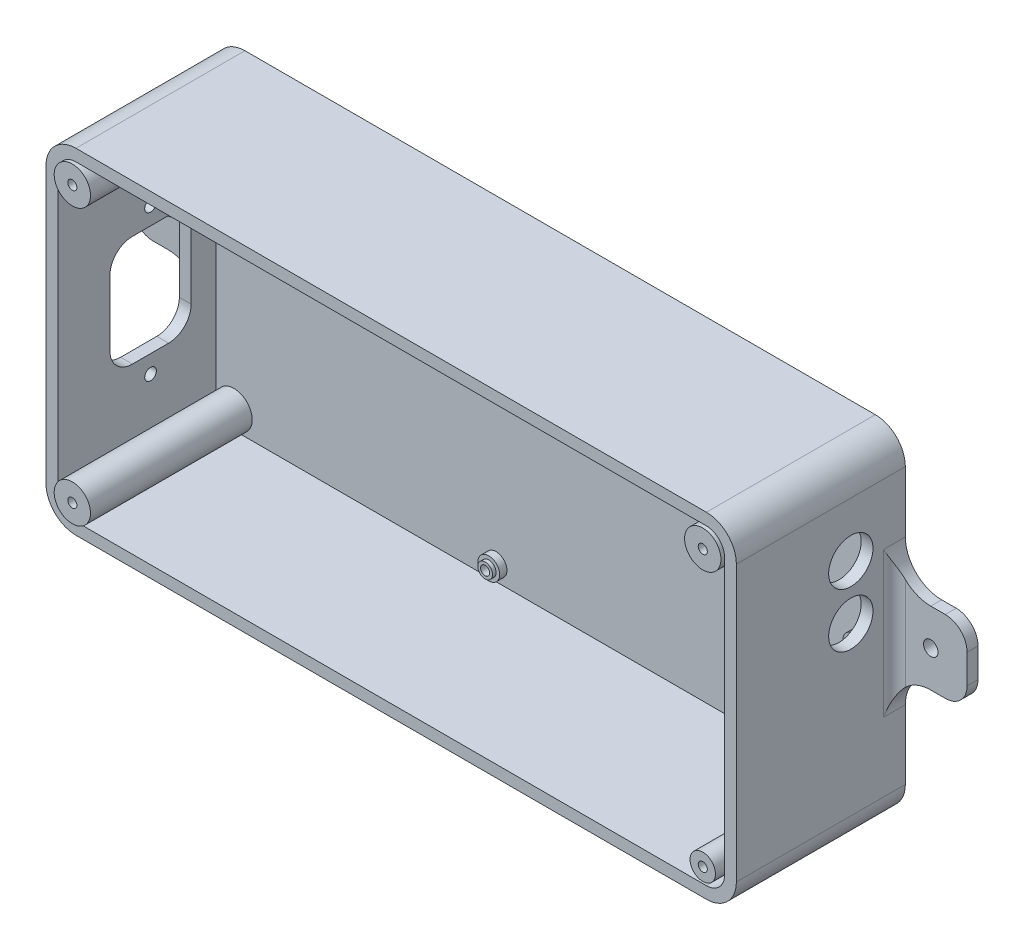
from build123d import *

# Parameters (mm, degrees)
BOSS_EXTRUDE1_DEPTH            = 3
BOSS_EXTRUDE5_START            = 3
BOSS_EXTRUDE5_DEPTH            = 43.5
BOSS_EXTRUDE6_START            = 3
SKETCH1_10_R                   = 3.5
SKETCH1_10_R_2                 = 5
BOSS_EXTRUDE6_DEPTH            = 44.5
BOSS_EXTRUDE7_START            = 3
SKETCH1_11_R                   = 2.175
SKETCH1_11_R_2                 = 2.025
BOSS_EXTRUDE7_DEPTH            = 3
BOSS_EXTRUDE8_START            = 3
SKETCH1_12_R                   = 3
SKETCH1_12_R_2                 = 3.135921206
SKETCH1_12_R_3                 = 3.419105212
BOSS_EXTRUDE8_DEPTH            = 2
CUT_EXTRUDE7_DEPTH             = 141.50814923
CUT_EXTRUDE7_DEPTH_BACK        = 141.50814923
SKETCH1_13_R                   = 1.25
CUT_EXTRUDE8_REACH             = 209.356
SKETCH3_R                      = 1.6
CUT_EXTRUDE8_DIRECTION_2_DEPTH = 208.356177627
CUT_EXTRUDE9_REACH             = 209.356
SKETCH4_R                      = 6.1
SKETCH5_R                      = 2
BOSS_EXTRUDE9_DEPTH            = 3
FILLET2_R                      = 10
FILLET3_R                      = 3


with BuildPart() as part:
    # Sketch1 → Boss-Extrude1 (new body)
    with BuildSketch(Plane.XY):
        with BuildLine():
            Line((-68.41, 24.13), (105.09, 24.13))
            ThreePointArc((105.09, 24.13), (110.923630945, 21.713630945), (113.34, 15.88))
            Line((113.34, 15.88), (113.34, -59.87))
            ThreePointArc((113.34, -59.87), (110.923630945, -65.703630945), (105.09, -68.12))
            Line((105.09, -68.12), (-68.41, -68.12))
            ThreePointArc((-68.41, -68.12), (-74.243630945, -65.703630945), (-76.66, -59.87))
            Line((-76.66, -59.87), (-76.66, 15.88))
            ThreePointArc((-76.66, 15.88), (-74.243630945, 21.713630945), (-68.41, 24.13))
        make_face()
    extrude(amount=BOSS_EXTRUDE1_DEPTH)

    # Sketch1<9> → Boss-Extrude5 (add)
    with BuildSketch(Plane.XY.offset(BOSS_EXTRUDE5_START)):
        with BuildLine():
            Line((-68.41, 24.13), (105.09, 24.13))
            ThreePointArc((105.09, 24.13), (110.923630945, 21.713630945), (113.34, 15.88))
            Line((113.34, 15.88), (113.34, -59.87))
            ThreePointArc((113.34, -59.87), (110.923630945, -65.703630945), (105.09, -68.12))
            Line((105.09, -68.12), (-68.41, -68.12))
            ThreePointArc((-68.41, -68.12), (-74.243630945, -65.703630945), (-76.66, -59.87))
            Line((-76.66, -59.87), (-76.66, 15.88))
            ThreePointArc((-76.66, 15.88), (-74.243630945, 21.713630945), (-68.41, 24.13))
        make_face()
        with BuildLine():
            Line((-68.41, 20.88), (105.09, 20.88))
            ThreePointArc((105.09, 20.88), (108.625533906, 19.415533906), (110.09, 15.88))
            Line((110.09, 15.88), (110.09, -59.87))
            ThreePointArc((110.09, -59.87), (108.625533906, -63.405533906), (105.09, -64.87))
            Line((105.09, -64.87), (-68.41, -64.87))
            ThreePointArc((-68.41, -64.87), (-71.945533906, -63.405533906), (-73.41, -59.87))
            Line((-73.41, -59.87), (-73.41, 15.88))
            ThreePointArc((-73.41, 15.88), (-71.945533906, 19.415533906), (-68.41, 20.88))
        make_face(mode=Mode.SUBTRACT)
    extrude(amount=BOSS_EXTRUDE5_DEPTH)

    # Sketch1<10> → Boss-Extrude6 (add)
    with BuildSketch(Plane.XY.offset(BOSS_EXTRUDE6_START)):
        with Locations((105.09, -59.87)):
            Circle(SKETCH1_10_R)
        with Locations((105.09, 15.88)):
            Circle(SKETCH1_10_R_2)
        with Locations(Location((-68.41, 15.88, 0), (0, 0, 180))):
            Circle(SKETCH1_10_R_2)
        with Locations(Location((-68.41, -59.87, 0), (0, 0, 180))):
            Circle(SKETCH1_10_R_2)
    extrude(amount=BOSS_EXTRUDE6_DEPTH)

    # Sketch1<11> → Boss-Extrude7 (add)
    with BuildSketch(Plane.XY.offset(BOSS_EXTRUDE7_START)):
        with Locations((104.265, -29.095)):
            Circle(SKETCH1_11_R)
        with Locations((104.265, -51.465)):
            Circle(SKETCH1_11_R)
        with Locations((3.695, -14.675)):
            Circle(SKETCH1_11_R_2)
        with Locations((83.915, -14.675)):
            Circle(SKETCH1_11_R_2)
        with Locations((83.915, -60.695)):
            Circle(SKETCH1_11_R_2)
        with Locations((3.695, -60.695)):
            Circle(SKETCH1_11_R_2)
    extrude(amount=BOSS_EXTRUDE7_DEPTH)

    # Sketch1<12> → Boss-Extrude8 (add)
    with BuildSketch(Plane.XY.offset(BOSS_EXTRUDE8_START)):
        with Locations((3.695, -14.675)):
            Circle(SKETCH1_12_R)
        with Locations((83.915, -14.675)):
            Circle(SKETCH1_12_R)
        with Locations((104.265, -29.095)):
            Circle(SKETCH1_12_R_2)
        with Locations((104.265, -51.465)):
            Circle(SKETCH1_12_R_3)
        with Locations((83.915, -60.695)):
            Circle(SKETCH1_12_R)
        with Locations((3.695, -60.695)):
            Circle(SKETCH1_12_R)
    extrude(amount=BOSS_EXTRUDE8_DEPTH)

    # Sketch1<13> → Cut-Extrude7 (cut, two sides: drawn at the far end of the back side and taken through both)
    with BuildSketch(Plane.XY.offset(-CUT_EXTRUDE7_DEPTH_BACK)):
        with Locations((-68.41, 15.88)):
            Circle(SKETCH1_13_R)
        with Locations((105.09, 15.88)):
            Circle(SKETCH1_13_R)
        with Locations((105.09, -59.87)):
            Circle(SKETCH1_13_R)
        with Locations((-68.41, -59.87)):
            Circle(SKETCH1_13_R)
        with Locations((104.265, -29.095)):
            Circle(SKETCH1_13_R)
        with Locations((104.265, -51.465)):
            Circle(SKETCH1_13_R)
        with Locations((3.695, -14.675)):
            Circle(SKETCH1_13_R)
        with Locations((83.915, -14.675)):
            Circle(SKETCH1_13_R)
        with Locations((83.915, -60.695)):
            Circle(SKETCH1_13_R)
        with Locations((3.695, -60.695)):
            Circle(SKETCH1_13_R)
    extrude(amount=CUT_EXTRUDE7_DEPTH + CUT_EXTRUDE7_DEPTH_BACK, mode=Mode.SUBTRACT)

    # Sketch3 → Cut-Extrude8 (cut, up to next)
    with BuildSketch(Plane.ZY.offset(76.66), mode=Mode.PRIVATE) as cut_extrude8_sk1:
        with Locations(Location((20.98, -44.95, 0), (0, 0, 90))):
            Circle(SKETCH3_R)
    cut_extrude8_tool1 = extrude(cut_extrude8_sk1.sketch, amount=-CUT_EXTRUDE8_REACH, mode=Mode.PRIVATE) & part.part
    # Sketch3 → Cut-Extrude8 (cut, up to next)
    with BuildSketch(Plane.ZY.offset(76.66), mode=Mode.PRIVATE) as cut_extrude8_sk2:
        with Locations(Location((20.98, -4.76, 0), (0, 0, 90))):
            Circle(SKETCH3_R)
    cut_extrude8_tool2 = extrude(cut_extrude8_sk2.sketch, amount=-CUT_EXTRUDE8_REACH, mode=Mode.PRIVATE) & part.part
    # Sketch3 → Cut-Extrude8 (cut, up to next)
    with BuildSketch(Plane.ZY.offset(76.66), mode=Mode.PRIVATE) as cut_extrude8_sk3:
        with BuildLine():
            Line((32.16, -15.84), (32.16, -33.87))
            ThreePointArc((32.16, -33.87), (30.344062043, -38.254062043), (25.96, -40.07))
            Line((25.96, -40.07), (16, -40.07))
            ThreePointArc((16, -40.07), (11.615937957, -38.254062043), (9.8, -33.87))
            Line((9.8, -33.87), (9.8, -15.84))
            ThreePointArc((9.8, -15.84), (11.615937957, -11.455937957), (16, -9.64))
            Line((16, -9.64), (25.96, -9.64))
            ThreePointArc((25.96, -9.64), (30.344062043, -11.455937957), (32.16, -15.84))
        make_face()
    cut_extrude8_tool3 = extrude(cut_extrude8_sk3.sketch, amount=-CUT_EXTRUDE8_REACH, mode=Mode.PRIVATE) & part.part
    add(cut_extrude8_tool1.solids().sort_by_distance((-76.66, -44.95, 20.98))[0], mode=Mode.SUBTRACT)
    add(cut_extrude8_tool2.solids().sort_by_distance((-76.66, -4.76, 20.98))[0], mode=Mode.SUBTRACT)
    add(cut_extrude8_tool3.solids().sort_by_distance((-76.66, -24.855, 20.98))[0], mode=Mode.SUBTRACT)

    # Sketch3 → Cut-Extrude8 direction 2 (cut)
    with BuildSketch(Plane.ZY.offset(76.66)):
        with Locations(Location((20.98, -44.95, 0), (0, 0, 90))):
            Circle(SKETCH3_R)
        with Locations(Location((20.98, -4.76, 0), (0, 0, 90))):
            Circle(SKETCH3_R)
        with BuildLine():
            Line((32.16, -15.84), (32.16, -33.87))
            ThreePointArc((32.16, -33.87), (30.344062043, -38.254062043), (25.96, -40.07))
            Line((25.96, -40.07), (16, -40.07))
            ThreePointArc((16, -40.07), (11.615937957, -38.254062043), (9.8, -33.87))
            Line((9.8, -33.87), (9.8, -15.84))
            ThreePointArc((9.8, -15.84), (11.615937957, -11.455937957), (16, -9.64))
            Line((16, -9.64), (25.96, -9.64))
            ThreePointArc((25.96, -9.64), (30.344062043, -11.455937957), (32.16, -15.84))
        make_face()
    extrude(amount=CUT_EXTRUDE8_DIRECTION_2_DEPTH, mode=Mode.SUBTRACT)

    # Sketch4 → Cut-Extrude9 (cut, up to next)
    with BuildSketch(Plane(origin=(113.34, 0, 0), x_dir=(0, 0, -1), z_dir=(1, 0, 0)), mode=Mode.PRIVATE) as cut_extrude9_sk1:
        with Locations(Location((-15, 0.88, 0), (0, 0, 90))):
            Circle(SKETCH4_R)
    cut_extrude9_tool1 = extrude(cut_extrude9_sk1.sketch, amount=-CUT_EXTRUDE9_REACH, mode=Mode.PRIVATE) & part.part
    # Sketch4 → Cut-Extrude9 (cut, up to next)
    with BuildSketch(Plane(origin=(113.34, 0, 0), x_dir=(0, 0, -1), z_dir=(1, 0, 0)), mode=Mode.PRIVATE) as cut_extrude9_sk2:
        with Locations(Location((-15, -14.05, 0), (0, 0, 90))):
            Circle(SKETCH4_R)
    cut_extrude9_tool2 = extrude(cut_extrude9_sk2.sketch, amount=-CUT_EXTRUDE9_REACH, mode=Mode.PRIVATE) & part.part
    add(cut_extrude9_tool1.solids().sort_by_distance((113.34, 0.88, 15))[0], mode=Mode.SUBTRACT)
    add(cut_extrude9_tool2.solids().sort_by_distance((113.34, -14.05, 15))[0], mode=Mode.SUBTRACT)

    # Sketch5 → Boss-Extrude9 (add)
    # profile 1 of 2: a face of its own
    with BuildSketch(Plane(origin=(0, 0, 0), x_dir=(-1, 0, 0), z_dir=(0, 0, -1))):
        with BuildLine():
            Line((76.66, -10.87), (90.66, -10.87))
            ThreePointArc((90.66, -10.87), (94.902640687, -12.627359313), (96.66, -16.87))
            Line((96.66, -16.87), (96.66, -24.87))
            ThreePointArc((96.66, -24.87), (94.902640687, -29.112640687), (90.66, -30.87))
            Line((90.66, -30.87), (76.66, -30.87))
            Line((76.66, -30.87), (76.66, -10.87))
        make_face()
        with Locations((86.66, -20.87)):
            Circle(SKETCH5_R, mode=Mode.SUBTRACT)
    # profile 2 of 2: a face of its own
    with BuildSketch(Plane(origin=(0, 0, 0), x_dir=(-1, 0, 0), z_dir=(0, 0, -1))):
        with BuildLine():
            Line((-113.34, -10.87), (-127.34, -10.87))
            ThreePointArc((-127.34, -10.87), (-131.582640687, -12.627359313), (-133.34, -16.87))
            Line((-133.34, -16.87), (-133.34, -24.87))
            ThreePointArc((-133.34, -24.87), (-131.582640687, -29.112640687), (-127.34, -30.87))
            Line((-127.34, -30.87), (-113.34, -30.87))
            Line((-113.34, -30.87), (-113.34, -10.87))
        make_face()
        with Locations((-123.34, -20.87)):
            Circle(SKETCH5_R, mode=Mode.SUBTRACT)
    extrude(amount=-BOSS_EXTRUDE9_DEPTH)

    # Fillet2
    fillet2_edges = [part.edges().sort_by_distance(p)[0] for p in [
        (-76.66, -30.87, 1.5),
        (-76.66, -10.87, 1.5),
        (113.34, -10.87, 1.5),
        (113.34, -30.87, 1.5),
    ]]
    fillet(fillet2_edges, radius=FILLET2_R)

    # Fillet3
    fillet3_edges = [part.edges().sort_by_distance(p)[0] for p in [
        (-76.66, -20.87, 3),
        (113.34, -20.87, 3),
    ]]
    fillet(fillet3_edges, radius=FILLET3_R)


solid = part.part
